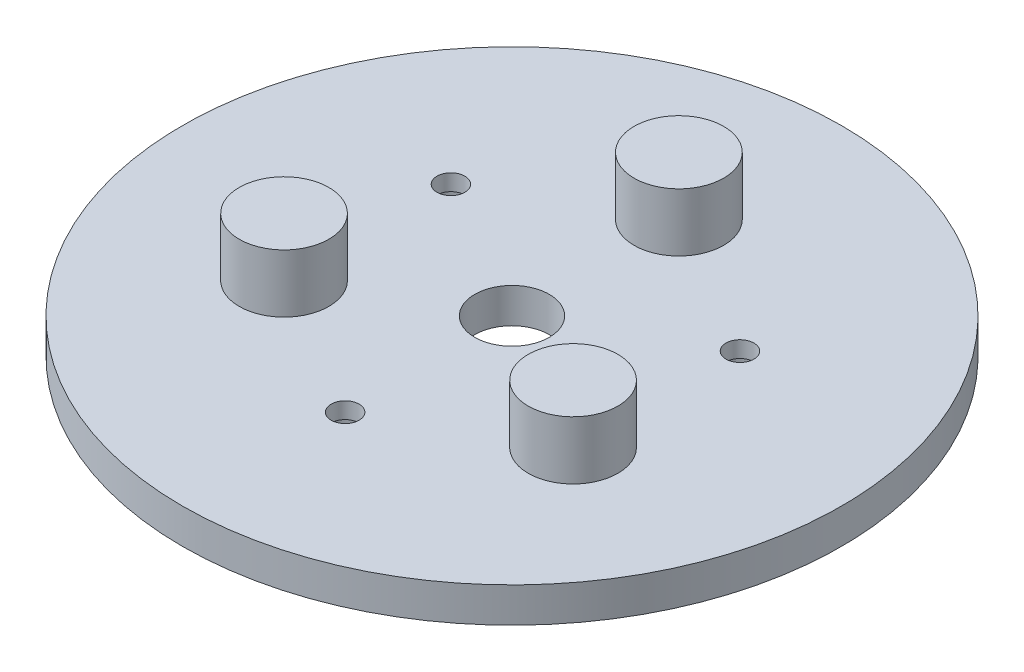
from build123d import *

# Parameters (mm, degrees)
SKETCH_1_R                   = 3.85
EXTRUDE_1_DEPTH              = 8
EXTRUDE_1_2_DEPTH            = 8
EXTRUDE_1_3_DEPTH            = 8
SKETCH_1_3_R                 = 28.3
SKETCH_1_3_R_2               = 3.85
SKETCH_1_3_R_3               = 0.5
EXTRUDE_2_DEPTH              = 3
SKETCH_2_R                   = 3.2
CUT_EXTRUDE_1_DEPTH          = 41.333360882
HOLE_WIZARD_M2_1_D           = 2.4
HOLE_WIZARD_M2_1_DEPTH       = 3
HOLE_WIZARD_M2_1_CBORE_D     = 5
HOLE_WIZARD_M2_1_CBORE_DEPTH = 1.6
HOLE_WIZARD_M2_1_TIP         = 0.721032743


with BuildPart() as part:
    # 스케치1 → 보스-돌출1 (new body)
    with BuildSketch(Plane(origin=(0, 0, 0), x_dir=(1, 0, 0), z_dir=(0, 1, 0))):
        with Locations((0, 14.33)):
            Circle(SKETCH_1_R)
    extrude(amount=EXTRUDE_1_DEPTH)



with BuildPart() as body_2:
    # 스케치1 → Extrude 1 2 (new body)
    with BuildSketch(Plane(origin=(0, 0, 0), x_dir=(1, 0, 0), z_dir=(0, 1, 0))):
        with Locations((12.410144036, -7.165)):
            Circle(SKETCH_1_R)
    extrude(amount=EXTRUDE_1_2_DEPTH)


with BuildPart() as body_3:
    # 스케치1 → Extrude 1 3 (new body)
    with BuildSketch(Plane(origin=(0, 0, 0), x_dir=(1, 0, 0), z_dir=(0, 1, 0))):
        with Locations((-12.410144036, -7.165)):
            Circle(SKETCH_1_R)
    extrude(amount=EXTRUDE_1_3_DEPTH)


with BuildPart() as part_1:
    add(part.part)

    add(body_2.part)  # 보스-돌출2 merges body 2

    add(body_3.part)  # 보스-돌출2 merges body 3
    # 스케치1<3> → 보스-돌출2 (add)
    with BuildSketch(Plane(origin=(0, 0, 0), x_dir=(1, 0, 0), z_dir=(0, 1, 0))):
        Circle(SKETCH_1_3_R)
        with Locations((-12.410144036, -7.165)):
            Circle(SKETCH_1_3_R_2, mode=Mode.SUBTRACT)
        with Locations((0, -14.33)):
            Circle(SKETCH_1_3_R_3, mode=Mode.SUBTRACT)
        with Locations((12.410144036, -7.165)):
            Circle(SKETCH_1_3_R_2, mode=Mode.SUBTRACT)
        with Locations((-12.410144036, 7.165)):
            Circle(SKETCH_1_3_R_3, mode=Mode.SUBTRACT)
        with Locations((12.410144036, 7.165)):
            Circle(SKETCH_1_3_R_3, mode=Mode.SUBTRACT)
        with BuildLine():
            ThreePointArc((0, 18.18), (2.722361108, 17.052361108), (3.85, 14.33))
            ThreePointArc((3.85, 14.33), (-2.722361108, 11.607638892), (0, 18.18))
        make_face(mode=Mode.SUBTRACT)
    extrude(amount=EXTRUDE_2_DEPTH)

    # 스케치2 → 컷-돌출1 (cut, through all)
    with BuildSketch(Plane(origin=(0, 3, 0), x_dir=(1, 0, 0), z_dir=(0, 1, 0))):
        Circle(SKETCH_2_R)
    extrude(amount=-CUT_EXTRUDE_1_DEPTH, mode=Mode.SUBTRACT)

    # M2 남비 머리 나사용 카운터보어1
    with Locations(Plane(origin=(0, 0, 0), x_dir=(-1, 0, 0), z_dir=(0, -1, 0))):
        with Locations((0, -14.33), (12.410144036, 7.165), (-12.410144036, 7.165)):
            CounterBoreHole(HOLE_WIZARD_M2_1_D / 2, HOLE_WIZARD_M2_1_CBORE_D / 2, HOLE_WIZARD_M2_1_CBORE_DEPTH, depth=HOLE_WIZARD_M2_1_DEPTH)
            with Locations((0, 0, -(HOLE_WIZARD_M2_1_DEPTH + HOLE_WIZARD_M2_1_TIP / 2))):  # 118° drill point
                Cone(0, HOLE_WIZARD_M2_1_D / 2, HOLE_WIZARD_M2_1_TIP, mode=Mode.SUBTRACT)


solid = part_1.part
